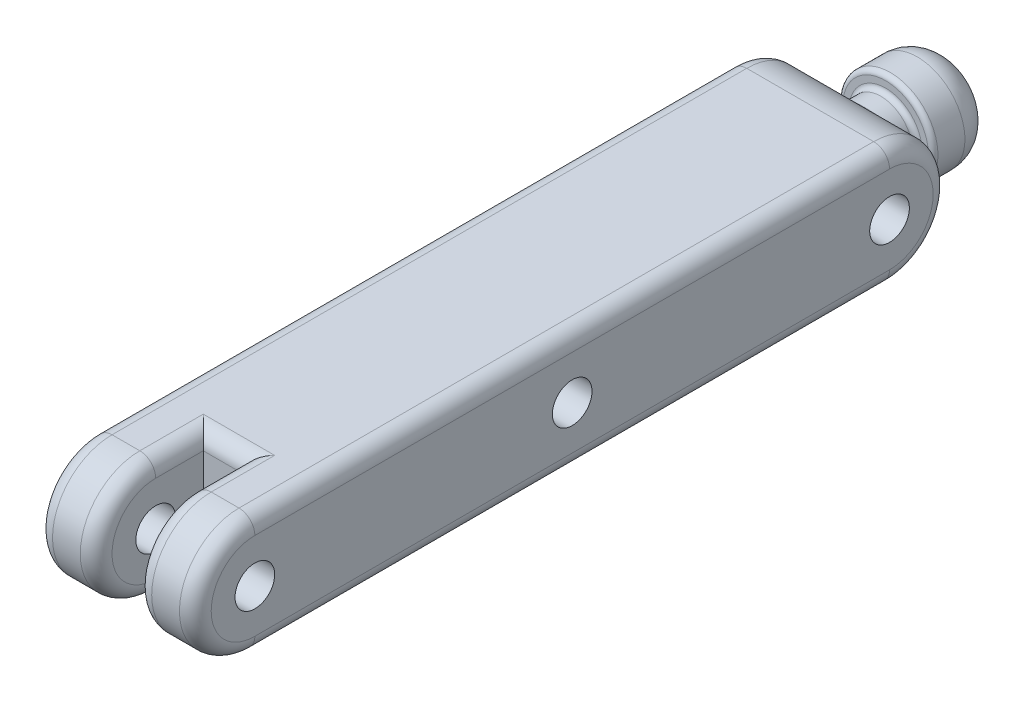
from build123d import *

# Parameters (mm, degrees)
SKETCH1_R                       = 1.5875
BOSS_EXTRUDE1_DEPTH             = 12.7
CUT_EXTRUDE1_DEPTH              = 1.5875
FILLET1_R                       = 1.27
BOSS_EXTRUDE2_REACH             = 63.831
BOSS_EXTRUDE2_END_RADIUS        = 4.7625
SKETCH2_R                       = 2.54
BOSS_EXTRUDE2_DIRECTION_2_DEPTH = 1.27
SKETCH6_R                       = 3.81
BOSS_EXTRUDE3_DEPTH             = 5.08
FILLET2_R                       = 2.54
FILLET3_R                       = 0.381


with BuildPart() as part:
    # Sketch1 → Boss-Extrude1 (new body)
    with BuildSketch(Plane(origin=(0, 0, 0), x_dir=(0, 0, -1), z_dir=(1, 0, 0))):
        with BuildLine():
            Line((-25.4, 4.7625), (25.4, 4.7625))
            ThreePointArc((25.4, 4.7625), (30.1625, 0), (25.4, -4.7625))
            Line((25.4, -4.7625), (-25.4, -4.7625))
            ThreePointArc((-25.4, -4.7625), (-30.1625, 0), (-25.4, 4.7625))
        make_face()
        Circle(SKETCH1_R, mode=Mode.SUBTRACT)
        with Locations((25.4, 0)):
            Circle(SKETCH1_R, mode=Mode.SUBTRACT)
        with Locations((-25.4, 0)):
            Circle(SKETCH1_R, mode=Mode.SUBTRACT)
    extrude(amount=BOSS_EXTRUDE1_DEPTH)

    # 3DSketch1 → Cut-Extrude1 (cut, symmetric)
    with BuildSketch(Plane(origin=(6.35, 4.7625, 25.4), x_dir=(0, -0.9284766908852594, -0.3713906763541036), z_dir=(1, 0, 0))):
        with BuildLine():
            Line((0, 0), (1.414998477, 3.537496192))
            Line((1.414998477, 3.537496192), (10.258738958, 0))
            Line((10.258738958, 0), (8.843740481, -3.537496192))
            ThreePointArc((8.843740481, -3.537496192), (2.653122144, -6.190618336), (0, 0))
        make_face()
    extrude(amount=CUT_EXTRUDE1_DEPTH, both=True, mode=Mode.SUBTRACT)

    # Fillet1
    fillet1_edges = [part.edges().sort_by_distance(p)[0] for p in [
        (12.7, 0, -30.1625),
        (12.7, 4.7625, 0),
        (7.9375, 4.7625, 23.495),
        (7.9375, -4.7625, 23.495),
        (4.7625, 4.7625, 23.495),
        (6.35, 4.7625, 21.59),
        (4.7625, -4.7625, 23.495),
        (12.7, 0, 30.1625),
        (0, 4.7625, 0),
        (0, 0, -30.1625),
        (0, -4.7625, 0),
        (0, 0, 30.1625),
        (12.7, -4.7625, 0),
    ]]
    fillet(fillet1_edges, radius=FILLET1_R)

    # Boss-Extrude2: up to this cylinder (the profile starts outside it)
    boss_extrude2_end = Plane(origin=(6.35, 0, -25.4), z_dir=(-1, 0, 0)) * Cylinder(BOSS_EXTRUDE2_END_RADIUS, 138.187, mode=Mode.PRIVATE)
    # Sketch2 → Boss-Extrude2 (add, up to the surface)
    with BuildSketch(Plane(origin=(0, 0, -30.1625), x_dir=(-1, 0, 0), z_dir=(0, 0, -1)), mode=Mode.PRIVATE) as boss_extrude2_sk1:
        with Locations(Location((-6.35, 0, 0), (0, 0, 180))):
            Circle(SKETCH2_R)
    boss_extrude2_tool1 = extrude(boss_extrude2_sk1.sketch, amount=-BOSS_EXTRUDE2_REACH, mode=Mode.PRIVATE) - boss_extrude2_end
    add(boss_extrude2_tool1.solids().sort_by_distance((6.35, 0, -30.1625))[0])
    add(boss_extrude2_tool1.solids().sort_by_distance((6.35, 0, -30.1625))[1])

    # Sketch2 → Boss-Extrude2 direction 2 (add)
    with BuildSketch(Plane(origin=(0, 0, -30.1625), x_dir=(-1, 0, 0), z_dir=(0, 0, -1))):
        with Locations(Location((-6.35, 0, 0), (0, 0, 180))):
            Circle(SKETCH2_R)
    extrude(amount=BOSS_EXTRUDE2_DIRECTION_2_DEPTH)

    # Sketch6 → Boss-Extrude3 (add)
    with BuildSketch(Plane(origin=(0, 0, -31.4325), x_dir=(-1, 0, 0), z_dir=(0, 0, -1))):
        with Locations((-6.35, 0)):
            Circle(SKETCH6_R)
    extrude(amount=BOSS_EXTRUDE3_DEPTH)

    # Fillet2
    fillet2_edges = [part.edges().sort_by_distance(p)[0] for p in [
        (10.16, 0, -36.5125),
    ]]
    fillet(fillet2_edges, radius=FILLET2_R)

    # Fillet3
    fillet3_edges = [part.edges().sort_by_distance(p)[0] for p in [
        (3.81, 0, -30.1625),
        (3.81, 0, -31.4325),
        (10.16, 0, -31.4325),
    ]]
    fillet(fillet3_edges, radius=FILLET3_R)


solid = part.part
